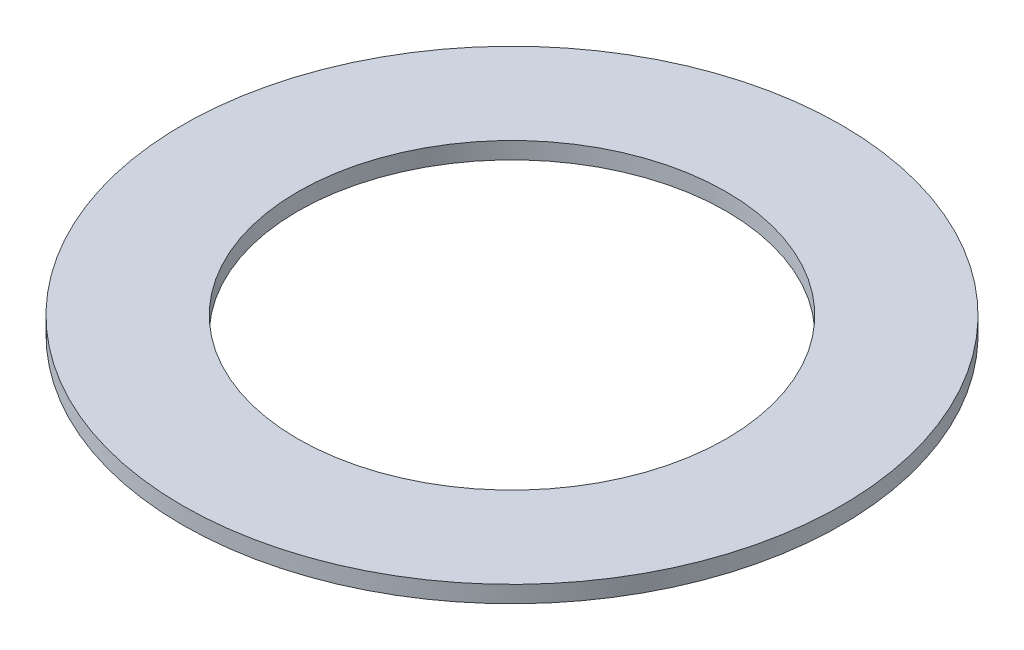
from build123d import *

# Parameters (mm, degrees)
SKETCH1_R           = 78.5
SKETCH1_R_2         = 51
BOSS_EXTRUDE1_DEPTH = 4


with BuildPart() as part:
    # Sketch1 → Boss-Extrude1 (new body)
    with BuildSketch(Plane(origin=(0, 0, 0), x_dir=(1, 0, 0), z_dir=(0, 1, 0))):
        with Locations(Location((0, 0, 0), (0, 0, 270))):
            Circle(SKETCH1_R)
        with Locations(Location((0, 0, 0), (0, 0, 270))):
            Circle(SKETCH1_R_2, mode=Mode.SUBTRACT)
    extrude(amount=BOSS_EXTRUDE1_DEPTH)


solid = part.part
